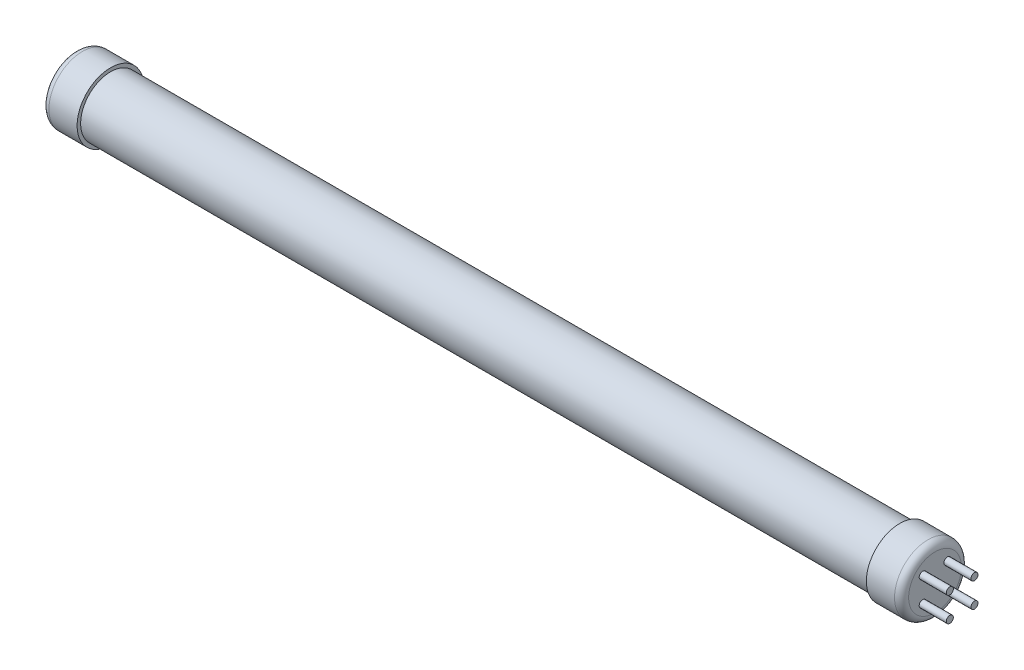
from build123d import *

# Parameters (mm, degrees)
SKETCH1_W           = 224.1
SKETCH1_H           = 8.5
SKETCH2_R           = 9.5
BOSS_EXTRUDE1_DEPTH = 10
FILLET1_R           = 2
SKETCH3_R           = 1
BOSS_EXTRUDE2_DEPTH = 7.7


with BuildPart() as part:
    # Sketch1 → Revolve1 (revolve)
    with BuildSketch(Plane(origin=(0, 0, 0), x_dir=(1, 0, 0), z_dir=(0, 1, 0)), mode=Mode.PRIVATE) as revolve1_sk:
        with Locations((0, 4.25)):
            Rectangle(SKETCH1_W, SKETCH1_H)
    revolve(revolve1_sk.sketch.rotate(Axis((-112.05, 0, 0), (1, 0, 0)), 180), axis=Axis((-112.05, 0, 0), (1, 0, 0)))

    # Sketch2 → Boss-Extrude1 (add)
    with BuildSketch(Plane.ZY.offset(112.05)):
        Circle(SKETCH2_R)
    boss_extrude1 = extrude(amount=BOSS_EXTRUDE1_DEPTH)

    # Mirror1: Boss-Extrude1 across plane
    add(boss_extrude1.mirror(Plane(origin=(0, 0, 0), x_dir=(0, 0, 1), z_dir=(1, 0, 0))))

    # Fillet1
    fillet1_edges = [part.edges().sort_by_distance(p)[0] for p in [
        (122.05, 0, -9.5),
        (-122.05, 0, -9.5),
    ]]
    fillet(fillet1_edges, radius=FILLET1_R)

    # Sketch3 → Boss-Extrude2 (add)
    with BuildSketch(Plane(origin=(122.05, 0, 0), x_dir=(0, 0, -1), z_dir=(1, 0, 0))):
        with Locations(Location((-3.5, 3.5, 0), (0, 0, 180))):
            Circle(SKETCH3_R)
        with Locations(Location((3.5, 3.5, 0), (0, 0, 180))):
            Circle(SKETCH3_R)
        with Locations(Location((3.5, -3.5, 0), (0, 0, 180))):
            Circle(SKETCH3_R)
        with Locations(Location((-3.5, -3.5, 0), (0, 0, 180))):
            Circle(SKETCH3_R)
    extrude(amount=BOSS_EXTRUDE2_DEPTH)


solid = part.part
